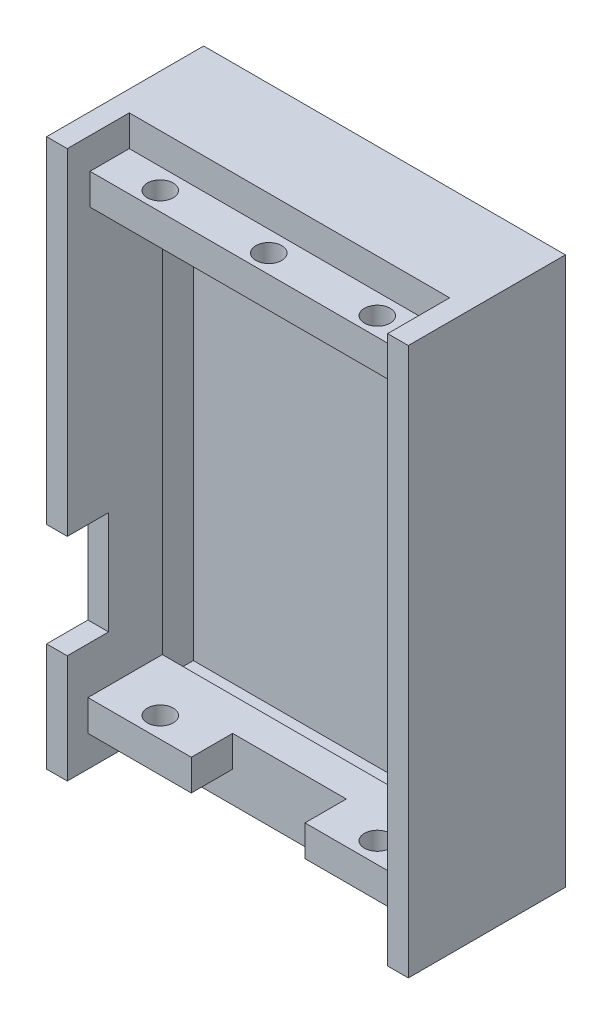
from build123d import *

# Parameters (mm, degrees)
SKETCH_1_W          = 35
SKETCH_1_H          = 53
EXTRUDE_1_DEPTH     = 2
SKETCH_2_W          = 2
SKETCH_2_H          = 53
EXTRUDE_2_DEPTH     = 13.2
SKETCH_3_W          = 31
SKETCH_3_H          = 3
EXTRUDE_3_DEPTH     = 7.2
SKETCH_4_W          = 31
SKETCH_4_H          = 3
EXTRUDE_4_DEPTH     = 13.2
CUT_EXTRUDE_1_REACH = 57.956
SKETCH_5_R          = 1.25
SKETCH_7_W          = 31
SKETCH_7_H          = 3
CUT_EXTRUDE_2_DEPTH = 2.2
SKETCH_8_W          = 31
SKETCH_8_H          = 3
CUT_EXTRUDE_3_DEPTH = 2
SKETCH_10_W         = 11
SKETCH_10_H         = 3
CUT_EXTRUDE_4_DEPTH = 4
CUT_EXTRUDE_START   = -3
SKETCH_9_R          = 1.25
CUT_EXTRUDE_5_DEPTH = 3
SKETCH_12_W         = 2
SKETCH_12_H         = 10
CUT_EXTRUDE_6_DEPTH = 4
SKETCH_13_W         = 33
SKETCH_13_H         = 47
CUT_EXTRUDE_7_DEPTH = 4


with BuildPart() as part:
    # 草图1 → 凸台-拉伸1 (new body)
    with BuildSketch(Plane.XY):
        with Locations((2.5, -6.5)):
            Rectangle(SKETCH_1_W, SKETCH_1_H)
    extrude(amount=EXTRUDE_1_DEPTH)

    # 草图2 → 凸台-拉伸2 (add)
    with BuildSketch(Plane.XY.offset(2)):
        with Locations((-14, -6.5)):
            Rectangle(SKETCH_2_W, SKETCH_2_H)
        with Locations((19, -6.5)):
            Rectangle(SKETCH_2_W, SKETCH_2_H)
    extrude(amount=EXTRUDE_2_DEPTH)

    # 草图3 → 凸台-拉伸3 (add)
    with BuildSketch(Plane.XY.offset(2)):
        with Locations((2.5, 18.5)):
            Rectangle(SKETCH_3_W, SKETCH_3_H)
        with Locations((2.5, -31.5)):
            Rectangle(SKETCH_3_W, SKETCH_3_H)
    extrude(amount=EXTRUDE_3_DEPTH)

    # 草图4 → 凸台-拉伸4 (add)
    with BuildSketch(Plane.XY.offset(2)):
        with Locations((2.5, 15.5)):
            Rectangle(SKETCH_4_W, SKETCH_4_H)
        with Locations((2.5, -28.5)):
            Rectangle(SKETCH_4_W, SKETCH_4_H)
    extrude(amount=EXTRUDE_4_DEPTH)

    # 草图5 → 切除-拉伸1 (cut, up to next)
    with BuildSketch(Plane(origin=(0, 17, 0), x_dir=(1, 0, 0), z_dir=(0, 1, 0)), mode=Mode.PRIVATE) as cut_extrude_1_sk1:
        with Locations(Location((-8, -11.2, 0), (0, 0, 270))):
            Circle(SKETCH_5_R)
    cut_extrude_1_tool1 = extrude(cut_extrude_1_sk1.sketch, amount=-CUT_EXTRUDE_1_REACH, mode=Mode.PRIVATE) & part.part
    # 草图5 → 切除-拉伸1 (cut, up to next)
    with BuildSketch(Plane(origin=(0, 17, 0), x_dir=(1, 0, 0), z_dir=(0, 1, 0)), mode=Mode.PRIVATE) as cut_extrude_1_sk2:
        with Locations(Location((2.5, -11.2, 0), (0, 0, 270))):
            Circle(SKETCH_5_R)
    cut_extrude_1_tool2 = extrude(cut_extrude_1_sk2.sketch, amount=-CUT_EXTRUDE_1_REACH, mode=Mode.PRIVATE) & part.part
    # 草图5 → 切除-拉伸1 (cut, up to next)
    with BuildSketch(Plane(origin=(0, 17, 0), x_dir=(1, 0, 0), z_dir=(0, 1, 0)), mode=Mode.PRIVATE) as cut_extrude_1_sk3:
        with Locations(Location((13, -11.2, 0), (0, 0, 270))):
            Circle(SKETCH_5_R)
    cut_extrude_1_tool3 = extrude(cut_extrude_1_sk3.sketch, amount=-CUT_EXTRUDE_1_REACH, mode=Mode.PRIVATE) & part.part
    add(cut_extrude_1_tool1.solids().sort_by_distance((-8, 17, 11.2))[0], mode=Mode.SUBTRACT)
    add(cut_extrude_1_tool2.solids().sort_by_distance((2.5, 17, 11.2))[0], mode=Mode.SUBTRACT)
    add(cut_extrude_1_tool3.solids().sort_by_distance((13, 17, 11.2))[0], mode=Mode.SUBTRACT)

    # 草图7 → 切除-拉伸2 (cut)
    with BuildSketch(Plane.XY.offset(15.2)):
        with Locations((2.5, 15.5)):
            Rectangle(SKETCH_7_W, SKETCH_7_H)
    extrude(amount=-CUT_EXTRUDE_2_DEPTH, mode=Mode.SUBTRACT)

    # 草图8 → 切除-拉伸3 (cut)
    with BuildSketch(Plane.XY.offset(15.2)):
        with Locations((2.5, -28.5)):
            Rectangle(SKETCH_8_W, SKETCH_8_H)
    extrude(amount=-CUT_EXTRUDE_3_DEPTH, mode=Mode.SUBTRACT)

    # 草图10 → 切除-拉伸4 (cut)
    with BuildSketch(Plane.XY.offset(13.2)):
        with Locations((2.5, -28.5)):
            Rectangle(SKETCH_10_W, SKETCH_10_H)
    extrude(amount=-CUT_EXTRUDE_4_DEPTH, mode=Mode.SUBTRACT)

    # 草图9 → 切除-拉伸5 (cut)
    with BuildSketch(Plane.XZ.offset(30).offset(CUT_EXTRUDE_START)):
        with Locations(Location((-8, 11.2, 0), (0, 0, 90))):
            Circle(SKETCH_9_R)
        with Locations(Location((13, 11.2, 0), (0, 0, 90))):
            Circle(SKETCH_9_R)
    extrude(amount=CUT_EXTRUDE_5_DEPTH, mode=Mode.SUBTRACT)

    # 草图12 → 切除-拉伸6 (cut)
    with BuildSketch(Plane.XY.offset(15.2)):
        with Locations((-14, -17.5)):
            Rectangle(SKETCH_12_W, SKETCH_12_H)
    extrude(amount=-CUT_EXTRUDE_6_DEPTH, mode=Mode.SUBTRACT)

    # 草图13 → 切除-拉伸7 (cut)
    with BuildSketch(Plane.XY.offset(2)):
        with Locations((2.5, -6.5)):
            Rectangle(SKETCH_13_W, SKETCH_13_H)
    extrude(amount=CUT_EXTRUDE_7_DEPTH, mode=Mode.SUBTRACT)


solid = part.part
